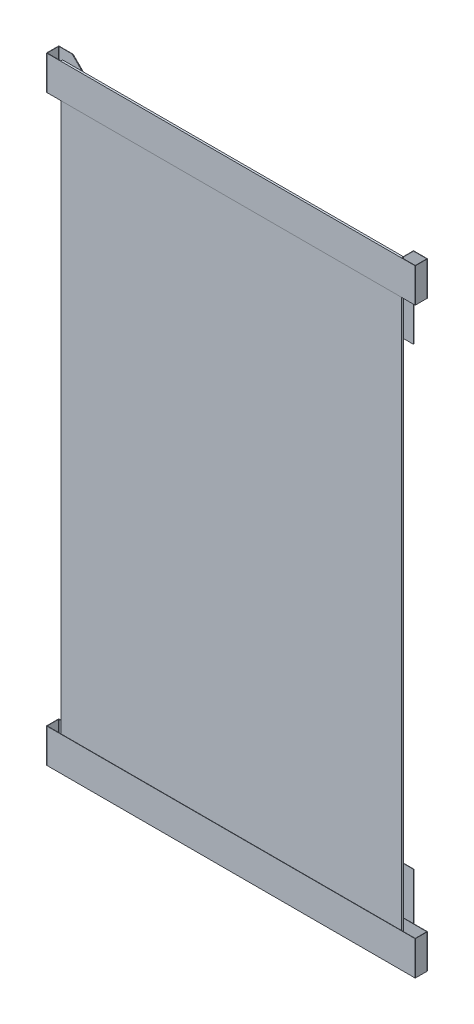
from build123d import *

# Parameters (mm, degrees)
SKETCH1_W            = 50
SKETCH1_H            = 88
BOSS_EXTRUDE1_DEPTH  = 0.25
BOSS_EXTRUDE2_DEPTH  = 5
SKETCH5_W            = 5
SKETCH5_H            = 11.9
BOSS_EXTRUDE3_DEPTH  = 0.05
CUT_EXTRUDE1_DEPTH   = 0.2
FILLET1_R            = 0.04
FILLET1_OF_MIRROR1_R = 0.04


with BuildPart() as part:
    # Sketch1 → Boss-Extrude1 (new body)
    with BuildSketch(Plane.XY.offset(0.25)):
        with Locations((0, 1.25)):
            Rectangle(SKETCH1_W, SKETCH1_H)
    extrude(amount=-BOSS_EXTRUDE1_DEPTH)

    # Sketch4 → Boss-Extrude2 (add)
    with BuildSketch(Plane(origin=(0, -45.25, 0), x_dir=(-1, 0, 0), z_dir=(0, -1, 0))):
        with BuildLine():
            Line((-26.95, -0.25), (26.95, -0.25))
            ThreePointArc((26.95, -0.25), (26.985355339, -0.235355339), (27, -0.2))
            Line((27, -0.2), (27, 1.4))
            ThreePointArc((27, 1.4), (26.985355339, 1.435355339), (26.95, 1.45))
            Line((26.95, 1.45), (20, 1.45))
            Line((20, 1.45), (20, 1.5))
            Line((20, 1.5), (27, 1.5))
            ThreePointArc((27, 1.5), (27.035355339, 1.485355339), (27.05, 1.45))
            Line((27.05, 1.45), (27.05, -0.25))
            ThreePointArc((27.05, -0.25), (27.035355339, -0.285355339), (27, -0.3))
            Line((27, -0.3), (-27, -0.3))
            ThreePointArc((-27, -0.3), (-27.035355339, -0.285355339), (-27.05, -0.25))
            Line((-27.05, -0.25), (-27.05, 1.45))
            ThreePointArc((-27.05, 1.45), (-27.035355339, 1.485355339), (-27, 1.5))
            Line((-27, 1.5), (-20, 1.5))
            Line((-20, 1.5), (-20, 1.45))
            Line((-20, 1.45), (-26.95, 1.45))
            ThreePointArc((-26.95, 1.45), (-26.985355339, 1.435355339), (-27, 1.4))
            Line((-27, 1.4), (-27, -0.2))
            ThreePointArc((-27, -0.2), (-26.985355339, -0.235355339), (-26.95, -0.25))
        make_face()
    boss_extrude2 = extrude(amount=-BOSS_EXTRUDE2_DEPTH)

    # Sketch5 → Boss-Extrude3 (add)
    with BuildSketch(Plane(origin=(0, 0, -1.5), x_dir=(-1, 0, 0), z_dir=(0, 0, -1))):
        with Locations((22.5, -39.3)):
            Rectangle(SKETCH5_W, SKETCH5_H)
        with Locations((-22.5, -39.3)):
            Rectangle(SKETCH5_W, SKETCH5_H)
    boss_extrude3 = extrude(amount=BOSS_EXTRUDE3_DEPTH)

    # Sketch6 → Cut-Extrude1 (cut)
    with BuildSketch(Plane(origin=(0, 0, -1.55), x_dir=(-1, 0, 0), z_dir=(0, 0, -1))):
        Polygon((20, -45.25), (25, -45.25), (20, -40.254912883), align=None)
        Polygon((-20, -40.254912883), (-25, -45.25), (-20, -45.25), align=None)
    cut_extrude1 = extrude(amount=-CUT_EXTRUDE1_DEPTH, mode=Mode.SUBTRACT)

    # Fillet1
    fillet1_edges = [part.edges().sort_by_distance(p)[0] for p in [
        (-22.5, -42.752456442, -1.45),
        (-22.5, -42.752456442, -1.55),
        (22.5, -42.752456442, -1.55),
        (22.5, -42.752456442, -1.45),
    ]]
    fillet(fillet1_edges, radius=FILLET1_R)

    # Mirror1: Boss-Extrude2, Boss-Extrude3, Cut-Extrude1 across plane
    add(boss_extrude2.mirror(Plane(origin=(0, 0, 0), x_dir=(0, 0, 1), z_dir=(0, -1, 0))))
    add(boss_extrude3.mirror(Plane(origin=(0, 0, 0), x_dir=(0, 0, 1), z_dir=(0, -1, 0))))
    add(cut_extrude1.mirror(Plane(origin=(0, 0, 0), x_dir=(0, 0, 1), z_dir=(0, -1, 0))), mode=Mode.SUBTRACT)

    # Fillet1 of Mirror1
    fillet1_of_mirror1_edges = [part.edges().sort_by_distance(p)[0] for p in [
        (-22.5, 42.752456442, -1.45),
        (-22.5, 42.752456442, -1.55),
        (22.5, 42.752456442, -1.55),
        (22.5, 42.752456442, -1.45),
    ]]
    fillet(fillet1_of_mirror1_edges, radius=FILLET1_OF_MIRROR1_R)


solid = part.part
